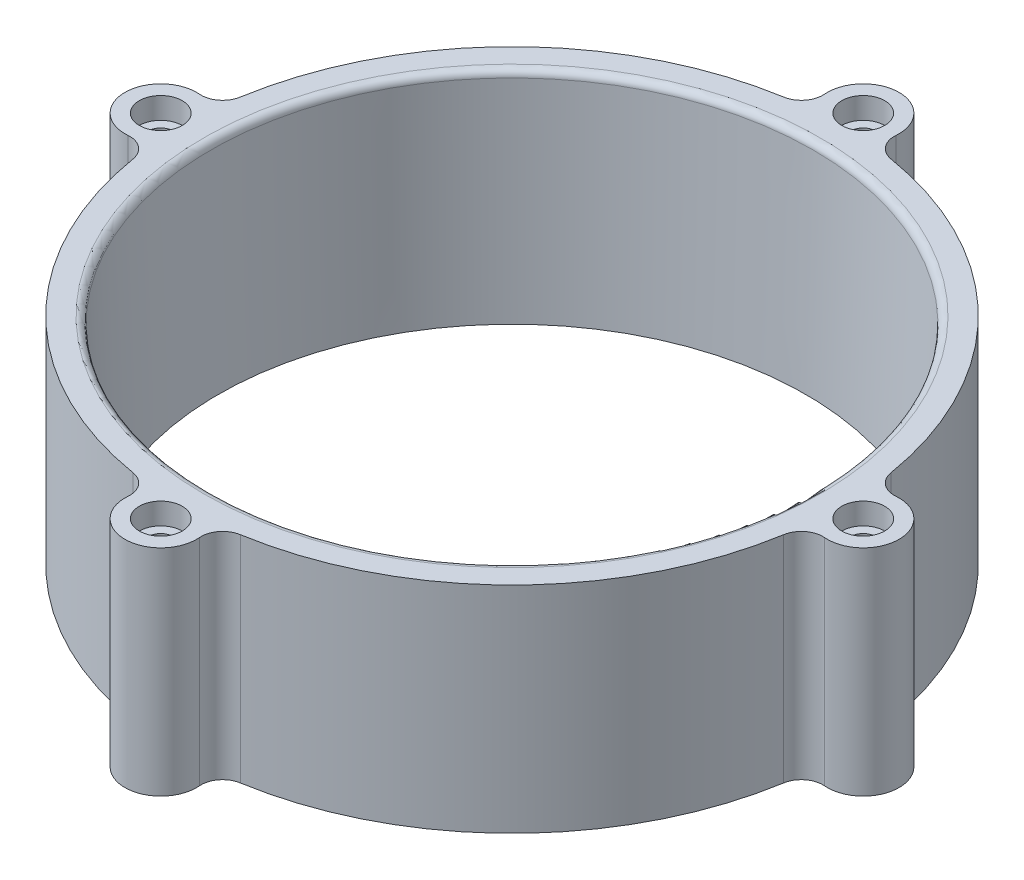
from build123d import *

# Parameters (mm, degrees)
SKETCH_1_R          = 41
SKETCH_1_R_2        = 1.7
EXTRUDE_1_DEPTH     = 30
FILLET_1_R          = 3
SKETCH_2_R          = 3
CUT_EXTRUDE_1_DEPTH = 3
DRAFT_1_ANGLE       = -2
FILLET_4_R          = 1


with BuildPart() as part:
    # 草图1 → 凸台-拉伸1 (new body)
    with BuildSketch(Plane(origin=(0, 0, 0), x_dir=(1, 0, 0), z_dir=(0, 1, 0))):
        with BuildLine():
            ThreePointArc((45.836734694, 3.872176727), (32.526911935, 32.526911935), (3.872176727, 45.836734694))
            ThreePointArc((3.872176727, 45.836734694), (0, 54), (-3.872176727, 45.836734694))
            ThreePointArc((-3.872176727, 45.836734694), (-32.526911935, 32.526911935), (-45.836734694, 3.872176727))
            ThreePointArc((-45.836734694, 3.872176727), (-54, 0), (-45.836734694, -3.872176727))
            ThreePointArc((-45.836734694, -3.872176727), (-32.526911935, -32.526911935), (-3.872176727, -45.836734694))
            ThreePointArc((-3.872176727, -45.836734694), (0, -54), (3.872176727, -45.836734694))
            ThreePointArc((3.872176727, -45.836734694), (32.526911935, -32.526911935), (45.836734694, -3.872176727))
            ThreePointArc((45.836734694, -3.872176727), (54, 0), (45.836734694, 3.872176727))
        make_face()
        with Locations(Location((0, 0, 0), (0, 0, 270))):
            Circle(SKETCH_1_R, mode=Mode.SUBTRACT)
        with Locations(Location((0, 49, 0), (0, 0, 270))):
            Circle(SKETCH_1_R_2, mode=Mode.SUBTRACT)
        with Locations(Location((49, 0, 0), (0, 0, 270))):
            Circle(SKETCH_1_R_2, mode=Mode.SUBTRACT)
        with Locations(Location((0, -49, 0), (0, 0, 270))):
            Circle(SKETCH_1_R_2, mode=Mode.SUBTRACT)
        with Locations(Location((-49, 0, 0), (0, 0, 270))):
            Circle(SKETCH_1_R_2, mode=Mode.SUBTRACT)
    extrude(amount=EXTRUDE_1_DEPTH)

    # 圆角1
    fillet_1_edges = [part.edges().sort_by_distance(p)[0] for p in [
        (-45.836734694, 15, 3.872176727),
        (-45.836734694, 15, -3.872176727),
        (-3.872176727, 15, -45.836734694),
        (3.872176727, 15, -45.836734694),
        (45.836734694, 15, -3.872176727),
        (45.836734694, 15, 3.872176727),
        (3.872176727, 15, 45.836734694),
        (-3.872176727, 15, 45.836734694),
    ]]
    fillet(fillet_1_edges, radius=FILLET_1_R)

    # 草图2 → 切除-拉伸1 (cut)
    with BuildSketch(Plane(origin=(0, 30, 0), x_dir=(1, 0, 0), z_dir=(0, 1, 0))):
        with Locations(Location((0, 49, 0), (0, 0, 270))):
            Circle(SKETCH_2_R)
        with Locations(Location((-49, 0, 0), (0, 0, 270))):
            Circle(SKETCH_2_R)
        with Locations(Location((0, -49, 0), (0, 0, 270))):
            Circle(SKETCH_2_R)
        with Locations(Location((49, 0, 0), (0, 0, 270))):
            Circle(SKETCH_2_R)
    extrude(amount=-CUT_EXTRUDE_1_DEPTH, mode=Mode.SUBTRACT)

    # 拔模1
    draft_1_faces = [part.faces().sort_by_distance(p)[0] for p in [
        (0, 15, -41),
    ]]
    draft(draft_1_faces, Plane(origin=(0, 0, 24.5), x_dir=(0, 0, -1), z_dir=(0, -1, 0)), DRAFT_1_ANGLE)

    # 圆角4
    fillet_4_edges = [part.edges().sort_by_distance(p)[0] for p in [
        (0, 30, -42.047623085),
    ]]
    fillet(fillet_4_edges, radius=FILLET_4_R)


solid = part.part
